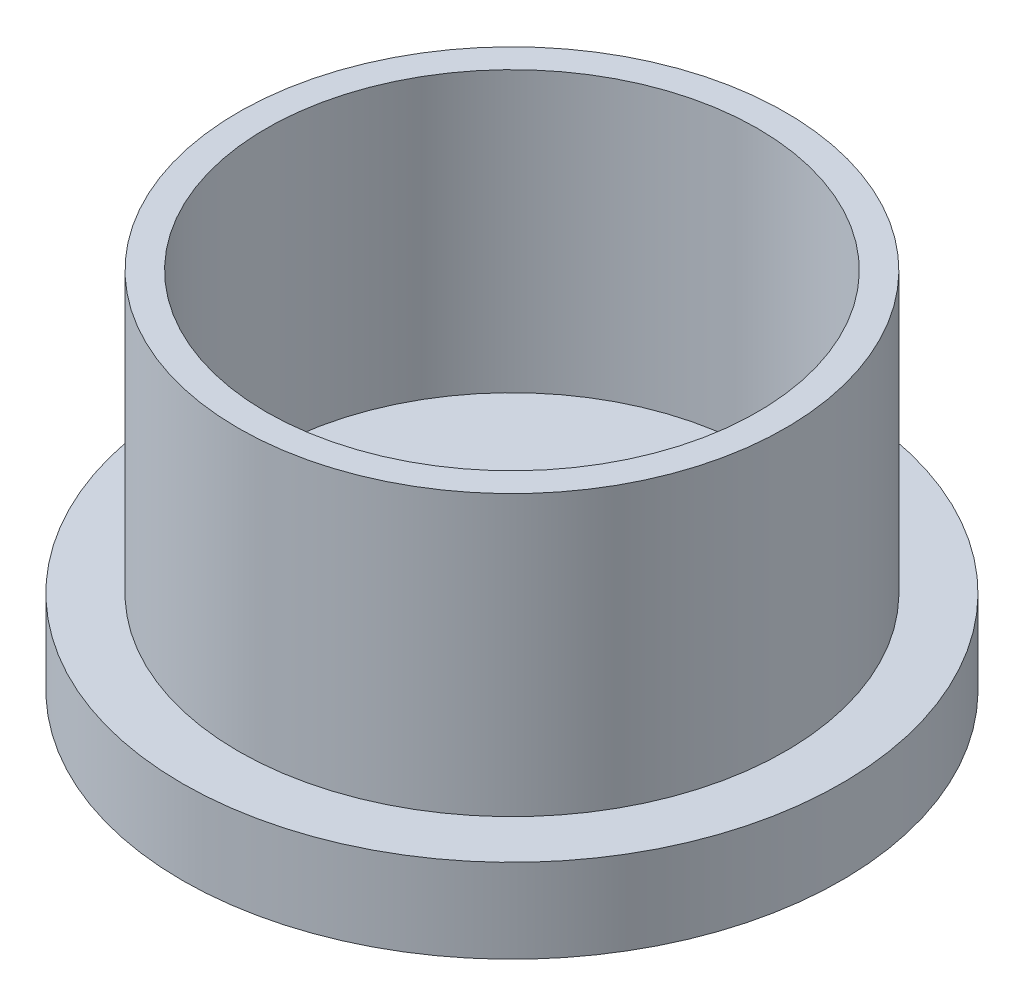
from build123d import *

# Parameters (mm, degrees)
SKETCH1_R           = 11.78
BOSS_EXTRUDE1_DEPTH = 3
SKETCH3_W           = 15.56
SKETCH3_H           = 0.5
CUT_EXTRUDE1_DEPTH  = 3
SKETCH4_W           = 0.5
SKETCH4_H           = 15.56
CUT_EXTRUDE2_DEPTH  = 3
SKETCH5_R           = 9.78
BOSS_EXTRUDE3_DEPTH = 10
SKETCH6_R           = 8.78
CUT_EXTRUDE3_DEPTH  = 10


with BuildPart() as part:
    # Sketch1 → Boss-Extrude1 (new body)
    with BuildSketch(Plane(origin=(0, 0, 0), x_dir=(1, 0, 0), z_dir=(0, 1, 0))):
        with Locations(Location((0, 0, 0), (0, 0, 270))):
            Circle(SKETCH1_R)
    extrude(amount=BOSS_EXTRUDE1_DEPTH)

    # Sketch3 → Cut-Extrude1 (cut)
    with BuildSketch(Plane(origin=(0, 3, 0), x_dir=(1, 0, 0), z_dir=(0, 1, 0))):
        Rectangle(SKETCH3_W, SKETCH3_H)
    extrude(amount=-CUT_EXTRUDE1_DEPTH, mode=Mode.SUBTRACT)

    # Sketch4 → Cut-Extrude2 (cut)
    with BuildSketch(Plane(origin=(0, 3, 0), x_dir=(1, 0, 0), z_dir=(0, 1, 0))):
        Rectangle(SKETCH4_W, SKETCH4_H)
    extrude(amount=-CUT_EXTRUDE2_DEPTH, mode=Mode.SUBTRACT)

    # Sketch5 → Boss-Extrude3 (add)
    with BuildSketch(Plane(origin=(0, 3, 0), x_dir=(1, 0, 0), z_dir=(0, 1, 0))):
        with Locations(Location((0, 0, 0), (0, 0, 270))):
            Circle(SKETCH5_R)
    extrude(amount=BOSS_EXTRUDE3_DEPTH)

    # Sketch6 → Cut-Extrude3 (cut)
    with BuildSketch(Plane(origin=(0, 13, 0), x_dir=(1, 0, 0), z_dir=(0, 1, 0))):
        with Locations(Location((0, 0, 0), (0, 0, 270))):
            Circle(SKETCH6_R)
    extrude(amount=-CUT_EXTRUDE3_DEPTH, mode=Mode.SUBTRACT)


solid = part.part
